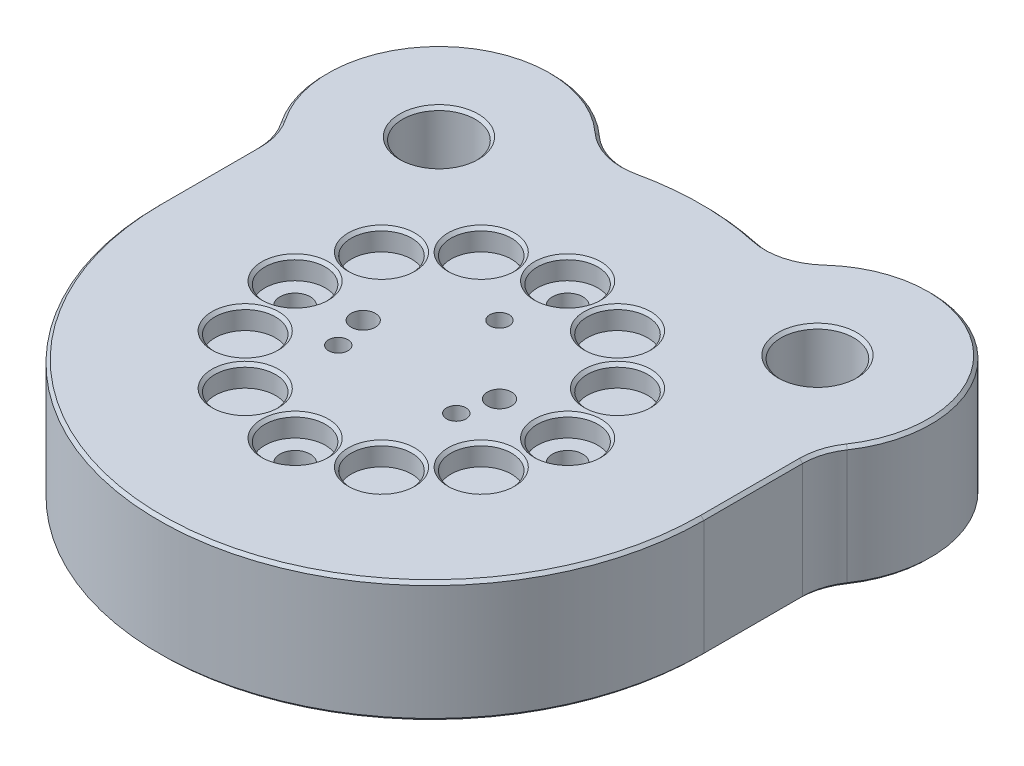
from build123d import *

# Parameters (mm, degrees)
BOSS_EXTRUDE1_DEPTH                                 = 40
FILLET1_R                                           = 20
CUT_EXTRUDE2_REACH                                  = 150.682
SKETCH3_R                                           = 12
SKETCH4_R                                           = 10
CUT_EXTRUDE3_DEPTH                                  = 7
CIRPATTERN1_COUNT                                   = 12
F_10_0_10_DIAMETER_HOLE1_D                          = 10
SKETCH8_R                                           = 8.5
CUT_EXTRUDE4_DEPTH                                  = 23
CBORE_FOR_M6_HEX_SOCKET_HEAD_CAP_SCREW1_D           = 6.4
CBORE_FOR_M6_HEX_SOCKET_HEAD_CAP_SCREW1_CBORE_D     = 11
CBORE_FOR_M6_HEX_SOCKET_HEAD_CAP_SCREW1_CBORE_DEPTH = 6.4
F_8_0MM_DOWEL_HOLE1_D                               = 8
CHAMFER1_SIZE                                       = 1
CHAMFER2_SIZE                                       = 0.5
CHAMFER3_SIZE                                       = 1


with BuildPart() as part:
    # Sketch1 → Boss-Extrude1 (new body)
    with BuildSketch(Plane(origin=(0, 0, 0), x_dir=(1, 0, 0), z_dir=(0, 1, 0))):
        with BuildLine():
            Line((-90, 0), (-90, 39.504902432))
            ThreePointArc((-90, 39.504902432), (-85.182396525, 94.862332258), (-30.561841884, 84.652075111))
            ThreePointArc((-30.561841884, 84.652075111), (0, 90), (30.561841884, 84.652075111))
            ThreePointArc((30.561841884, 84.652075111), (85.182396525, 94.862332258), (90, 39.504902432))
            Line((90, 39.504902432), (90, 0))
            ThreePointArc((90, 0), (0, -90), (-90, 0))
        make_face()
    extrude(amount=-BOSS_EXTRUDE1_DEPTH)

    # Fillet1
    fillet1_edges = [part.edges().sort_by_distance(p)[0] for p in [
        (30.561841884, -20, -84.652075111),
        (90, -20, -39.504902432),
        (-90, -20, -39.504902432),
        (-30.561841884, -20, -84.652075111),
    ]]
    fillet(fillet1_edges, radius=FILLET1_R)

    # Sketch3 → Cut-Extrude2 (cut, up to next)
    with BuildSketch(Plane(origin=(0, 0, 0), x_dir=(1, 0, 0), z_dir=(0, 1, 0)), mode=Mode.PRIVATE) as cut_extrude2_sk1:
        with Locations(Location((-62.5, 65, 0), (0, 0, 270))):
            Circle(SKETCH3_R)
    cut_extrude2_tool1 = extrude(cut_extrude2_sk1.sketch, amount=-CUT_EXTRUDE2_REACH, mode=Mode.PRIVATE) & part.part
    # Sketch3 → Cut-Extrude2 (cut, up to next)
    with BuildSketch(Plane(origin=(0, 0, 0), x_dir=(1, 0, 0), z_dir=(0, 1, 0)), mode=Mode.PRIVATE) as cut_extrude2_sk2:
        with Locations(Location((62.5, 65, 0), (0, 0, 270))):
            Circle(SKETCH3_R)
    cut_extrude2_tool2 = extrude(cut_extrude2_sk2.sketch, amount=-CUT_EXTRUDE2_REACH, mode=Mode.PRIVATE) & part.part
    add(cut_extrude2_tool1.solids().sort_by_distance((-62.5, 0, -65))[0], mode=Mode.SUBTRACT)
    add(cut_extrude2_tool2.solids().sort_by_distance((62.5, 0, -65))[0], mode=Mode.SUBTRACT)

    # Sketch4 → Cut-Extrude3 (cut)
    with BuildSketch(Plane(origin=(0, 0, 0), x_dir=(1, 0, 0), z_dir=(0, 1, 0))):
        with Locations(Location((0, 45, 0), (0, 0, 270))):
            Circle(SKETCH4_R)
    cut_extrude3 = extrude(amount=-CUT_EXTRUDE3_DEPTH, mode=Mode.SUBTRACT)

    # CirPattern1: Cut-Extrude3 ×12 about axis
    cirpattern1_axis = Axis((0, 0, 0), (0, 1, 0))
    for i in range(1, CIRPATTERN1_COUNT):
        add(cut_extrude3.rotate(cirpattern1_axis, i * 360 / CIRPATTERN1_COUNT), mode=Mode.SUBTRACT)

    # Ø10.0 (10) Diameter Hole1 (through all)
    with Locations(Plane(origin=(0, 0, 0), x_dir=(1, 0, 0), z_dir=(0, 1, 0))):
        with Locations((0, 45), (45, 0), (0, -45), (-45, 0)):
            Hole(F_10_0_10_DIAMETER_HOLE1_D / 2)

    # Sketch8 → Cut-Extrude4 (cut)
    with BuildSketch(Plane.XZ.offset(40)):
        with Locations(Location((0, 45, 0), (0, 0, 270))):
            Circle(SKETCH8_R)
        with Locations(Location((45, 0, 0), (0, 0, 270))):
            Circle(SKETCH8_R)
        with Locations(Location((0, -45, 0), (0, 0, 270))):
            Circle(SKETCH8_R)
        with Locations(Location((-45, 0, 0), (0, 0, 270))):
            Circle(SKETCH8_R)
    extrude(amount=-CUT_EXTRUDE4_DEPTH, mode=Mode.SUBTRACT)

    # CBORE for M6 Hex Socket Head Cap Screw1 (through all)
    with Locations(Plane(origin=(0, -40, 0), x_dir=(-1, 0, 0), z_dir=(0, -1, 0))):
        with Locations((0, 22.5), (-19.485571585, -11.25), (19.485571585, -11.25)):
            CounterBoreHole(CBORE_FOR_M6_HEX_SOCKET_HEAD_CAP_SCREW1_D / 2, CBORE_FOR_M6_HEX_SOCKET_HEAD_CAP_SCREW1_CBORE_D / 2, CBORE_FOR_M6_HEX_SOCKET_HEAD_CAP_SCREW1_CBORE_DEPTH)

    # Ø8.0mm Dowel Hole1 (through all)
    with Locations(Plane(origin=(0, 0, 0), x_dir=(1, 0, 0), z_dir=(0, 1, 0))):
        with Locations((-22.5, 0), (22.5, 0)):
            Hole(F_8_0MM_DOWEL_HOLE1_D / 2)

    # Chamfer1
    chamfer1_edges = [part.edges().sort_by_distance(p)[0] for p in [
        (0, -40, 90),
        (87.062864481, 0, -93.335766948),
        (87.062864481, -40, -93.335766948),
        (90, -40, -16.298148254),
        (0, 0, -90),
        (0, -40, -90),
        (-87.062864481, 0, -93.335766948),
        (-87.062864481, -40, -93.335766948),
        (-90, 0, -16.298148254),
        (-90, -40, -16.298148254),
        (28.863873105, 0, -88.103017476),
        (28.863873105, -40, -88.103017476),
        (-28.863873105, 0, -88.103017476),
        (-28.863873105, -40, -88.103017476),
        (90.889338282, 0, -38.493974754),
        (90.889338282, -40, -38.493974754),
        (-90.889338282, 0, -38.493974754),
        (-90.889338282, -40, -38.493974754),
        (-62.5, 0, -77),
        (-62.5, -40, -77),
        (62.5, 0, -77),
        (62.5, -40, -77),
        (90, 0, -16.298148254),
        (0, 0, 90),
    ]]
    chamfer(chamfer1_edges, length=CHAMFER1_SIZE)

    # Chamfer2
    chamfer2_edges = [part.edges().sort_by_distance(p)[0] for p in [
        (0, -40, 53.5),
        (45, -40, 8.5),
        (0, -40, -36.5),
        (-45, -40, 8.5),
    ]]
    chamfer(chamfer2_edges, length=CHAMFER2_SIZE)

    # Chamfer3
    chamfer3_edges = [part.edges().sort_by_distance(p)[0] for p in [
        (0, 0, -55),
        (-47.631397208, 0, -27.5),
        (-55, 0, 0),
        (-27.5, 0, 47.631397208),
        (-47.631397208, 0, 27.5),
        (55, 0, 0),
        (47.631397208, 0, 27.5),
        (27.5, 0, 47.631397208),
        (0, 0, 55),
        (27.5, 0, -47.631397208),
        (47.631397208, 0, -27.5),
        (-27.5, 0, -47.631397208),
    ]]
    chamfer(chamfer3_edges, length=CHAMFER3_SIZE)


solid = part.part
